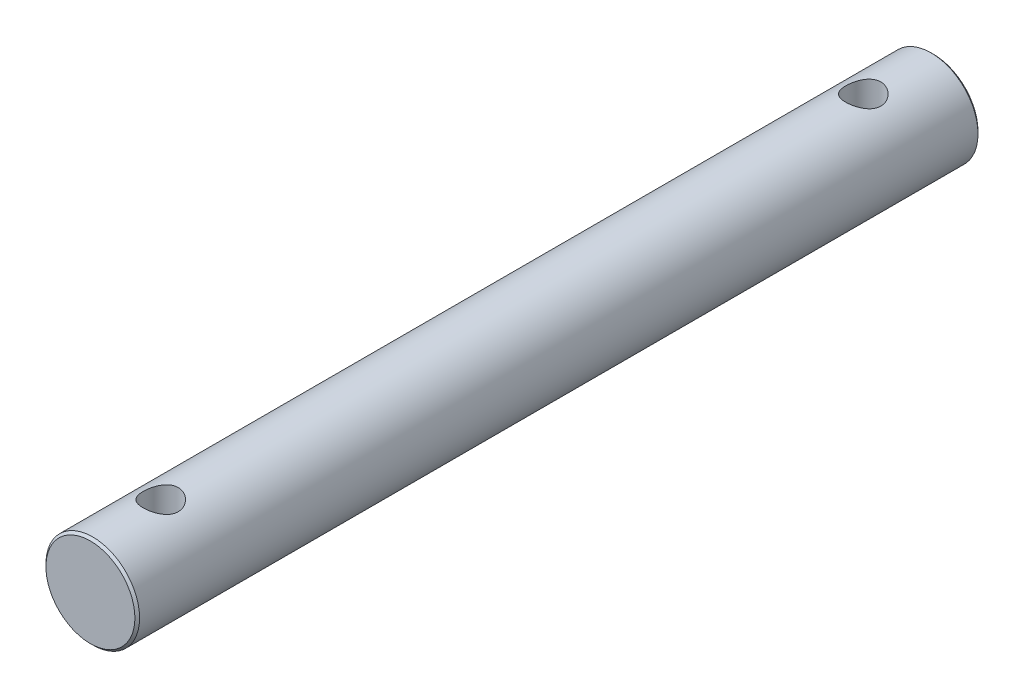
from build123d import *

# Parameters (mm, degrees)
SKETCH_1_R          = 4
EXTRUDE_1_DEPTH     = 26
SKETCH_2_R          = 4
EXTRUDE_2_DEPTH     = 36
SKETCH_3_R          = 1.5
CUT_EXTRUDE_1_DEPTH = 37.441734317
CHAMFER_1_SIZE      = 0.2


with BuildPart() as part:
    # ｽｹｯﾁ1 → ﾎﾞｽ - 押し出し1 (new, symmetric)
    with BuildSketch(Plane.XY):
        with Locations(Location((0, 0, 0), (0, 0, 180))):
            Circle(SKETCH_1_R)
    extrude(amount=EXTRUDE_1_DEPTH, both=True)

    # ｽｹｯﾁ2 → ﾎﾞｽ - 押し出し2 (add, symmetric)
    with BuildSketch(Plane.XY):
        with Locations(Location((0, 0, 0), (0, 0, 180))):
            Circle(SKETCH_2_R)
    extrude(amount=EXTRUDE_2_DEPTH, both=True)

    # ｽｹｯﾁ3 → ｶｯﾄ - 押し出し1 (cut, symmetric)
    with BuildSketch(Plane(origin=(0, 0, 0), x_dir=(1, 0, 0), z_dir=(0, 1, 0))):
        with Locations(Location((0, 30, 0), (0, 0, 270))):
            Circle(SKETCH_3_R)
    cut_extrude_1 = extrude(amount=CUT_EXTRUDE_1_DEPTH, both=True, mode=Mode.SUBTRACT)

    # ﾐﾗｰ1: ｶｯﾄ - 押し出し1 across plane
    add(cut_extrude_1.mirror(Plane.XY), mode=Mode.SUBTRACT)

    # 面取り1
    chamfer_1_edges = [part.edges().sort_by_distance(p)[0] for p in [
        (4, 0, -36),
        (4, 0, 36),
    ]]
    chamfer(chamfer_1_edges, length=CHAMFER_1_SIZE)


solid = part.part
